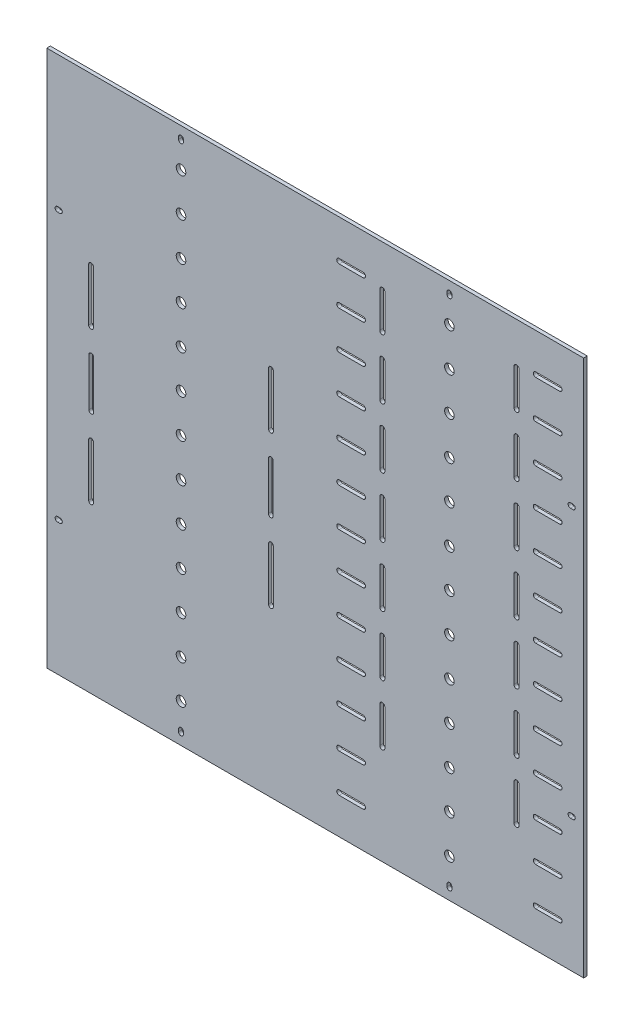
from build123d import *

# Parameters (mm, degrees)
SCHIZZO1_W                   = 448
SCHIZZO1_H                   = 448
SCHIZZO1_R                   = 4
ESTRUSIONE_ESTRUSIONE1_DEPTH = 3


with BuildPart() as part:
    # Schizzo1 → Estrusione-Estrusione1 (new body)
    with BuildSketch(Plane.XY):
        with Locations((224, 224)):
            Rectangle(SCHIZZO1_W, SCHIZZO1_H)
        with Locations((335.970716632, 416)):
            Circle(SCHIZZO1_R, mode=Mode.SUBTRACT)
        with Locations((335.970716632, 384)):
            Circle(SCHIZZO1_R, mode=Mode.SUBTRACT)
        with Locations((335.970716632, 352)):
            Circle(SCHIZZO1_R, mode=Mode.SUBTRACT)
        with Locations((335.970716632, 320)):
            Circle(SCHIZZO1_R, mode=Mode.SUBTRACT)
        with Locations((335.970716632, 288)):
            Circle(SCHIZZO1_R, mode=Mode.SUBTRACT)
        with Locations((335.970716632, 256)):
            Circle(SCHIZZO1_R, mode=Mode.SUBTRACT)
        with Locations((335.970716632, 224)):
            Circle(SCHIZZO1_R, mode=Mode.SUBTRACT)
        with Locations((335.970716632, 192)):
            Circle(SCHIZZO1_R, mode=Mode.SUBTRACT)
        with Locations((335.970716632, 160)):
            Circle(SCHIZZO1_R, mode=Mode.SUBTRACT)
        with Locations((335.970716632, 128)):
            Circle(SCHIZZO1_R, mode=Mode.SUBTRACT)
        with Locations((335.970716632, 96)):
            Circle(SCHIZZO1_R, mode=Mode.SUBTRACT)
        with Locations((335.970716632, 64)):
            Circle(SCHIZZO1_R, mode=Mode.SUBTRACT)
        with Locations((335.970716632, 32)):
            Circle(SCHIZZO1_R, mode=Mode.SUBTRACT)
        with Locations(Location((112.029283368, 32, 0), (0, 0, 180))):
            Circle(SCHIZZO1_R, mode=Mode.SUBTRACT)
        with Locations(Location((112.029283368, 64, 0), (0, 0, 180))):
            Circle(SCHIZZO1_R, mode=Mode.SUBTRACT)
        with Locations(Location((112.029283368, 96, 0), (0, 0, 180))):
            Circle(SCHIZZO1_R, mode=Mode.SUBTRACT)
        with Locations(Location((112.029283368, 128, 0), (0, 0, 180))):
            Circle(SCHIZZO1_R, mode=Mode.SUBTRACT)
        with Locations(Location((112.029283368, 160, 0), (0, 0, 180))):
            Circle(SCHIZZO1_R, mode=Mode.SUBTRACT)
        with Locations(Location((112.029283368, 192, 0), (0, 0, 180))):
            Circle(SCHIZZO1_R, mode=Mode.SUBTRACT)
        with Locations(Location((112.029283368, 224, 0), (0, 0, 180))):
            Circle(SCHIZZO1_R, mode=Mode.SUBTRACT)
        with Locations(Location((112.029283368, 256, 0), (0, 0, 180))):
            Circle(SCHIZZO1_R, mode=Mode.SUBTRACT)
        with Locations(Location((112.029283368, 288, 0), (0, 0, 180))):
            Circle(SCHIZZO1_R, mode=Mode.SUBTRACT)
        with Locations(Location((112.029283368, 320, 0), (0, 0, 180))):
            Circle(SCHIZZO1_R, mode=Mode.SUBTRACT)
        with Locations(Location((112.029283368, 352, 0), (0, 0, 180))):
            Circle(SCHIZZO1_R, mode=Mode.SUBTRACT)
        with Locations(Location((112.029283368, 384, 0), (0, 0, 180))):
            Circle(SCHIZZO1_R, mode=Mode.SUBTRACT)
        with Locations(Location((112.029283368, 416, 0), (0, 0, 180))):
            Circle(SCHIZZO1_R, mode=Mode.SUBTRACT)
        with BuildLine():
            Line((9, 338), (11, 338))
            ThreePointArc((11, 338), (13, 336), (11, 334))
            Line((11, 334), (9, 334))
            ThreePointArc((9, 334), (7, 336), (9, 338))
        make_face(mode=Mode.SUBTRACT)
        with BuildLine():
            Line((9, 110), (11, 110))
            ThreePointArc((11, 110), (13, 112), (11, 114))
            Line((11, 114), (9, 114))
            ThreePointArc((9, 114), (7, 112), (9, 110))
        make_face(mode=Mode.SUBTRACT)
        with BuildLine():
            Line((439, 110), (437, 110))
            ThreePointArc((437, 110), (435, 112), (437, 114))
            Line((437, 114), (439, 114))
            ThreePointArc((439, 114), (441, 112), (439, 110))
        make_face(mode=Mode.SUBTRACT)
        with BuildLine():
            Line((439, 338), (437, 338))
            ThreePointArc((437, 338), (435, 336), (437, 334))
            Line((437, 334), (439, 334))
            ThreePointArc((439, 334), (441, 336), (439, 338))
        make_face(mode=Mode.SUBTRACT)
        with BuildLine():
            Line((114, 439), (114, 437))
            ThreePointArc((114, 437), (112, 435), (110, 437))
            Line((110, 437), (110, 439))
            ThreePointArc((110, 439), (112, 441), (114, 439))
        make_face(mode=Mode.SUBTRACT)
        with BuildLine():
            Line((334, 439), (334, 437))
            ThreePointArc((334, 437), (336, 435), (338, 437))
            Line((338, 437), (338, 439))
            ThreePointArc((338, 439), (336, 441), (334, 439))
        make_face(mode=Mode.SUBTRACT)
        with BuildLine():
            Line((114, 9), (114, 11))
            ThreePointArc((114, 11), (112, 13), (110, 11))
            Line((110, 11), (110, 9))
            ThreePointArc((110, 9), (112, 7), (114, 9))
        make_face(mode=Mode.SUBTRACT)
        with BuildLine():
            Line((334, 9), (334, 11))
            ThreePointArc((334, 11), (336, 13), (338, 11))
            Line((338, 11), (338, 9))
            ThreePointArc((338, 9), (336, 7), (334, 9))
        make_face(mode=Mode.SUBTRACT)
        with BuildLine():
            Line((34.958788995, 265.366145204), (34.958788995, 309.366145204))
            ThreePointArc((34.958788995, 309.366145204), (36.958788995, 311.366145204), (38.958788995, 309.366145204))
            Line((38.958788995, 309.366145204), (38.958788995, 265.366145204))
            ThreePointArc((38.958788995, 265.366145204), (36.958788995, 263.366145204), (34.958788995, 265.366145204))
        make_face(mode=Mode.SUBTRACT)
        with BuildLine():
            Line((34.958788995, 182.633854796), (34.958788995, 138.633854796))
            ThreePointArc((34.958788995, 138.633854796), (36.958788995, 136.633854796), (38.958788995, 138.633854796))
            Line((38.958788995, 138.633854796), (38.958788995, 182.633854796))
            ThreePointArc((38.958788995, 182.633854796), (36.958788995, 184.633854796), (34.958788995, 182.633854796))
        make_face(mode=Mode.SUBTRACT)
        with BuildLine():
            Line((35.086959829, 204.138830615), (35.086959829, 244.138830615))
            ThreePointArc((35.086959829, 244.138830615), (37.086959829, 246.138830615), (39.086959829, 244.138830615))
            Line((39.086959829, 244.138830615), (39.086959829, 204.138830615))
            ThreePointArc((39.086959829, 204.138830615), (37.086959829, 202.138830615), (35.086959829, 204.138830615))
        make_face(mode=Mode.SUBTRACT)
        with BuildLine():
            Line((189.041211005, 265.366145204), (189.041211005, 309.366145204))
            ThreePointArc((189.041211005, 309.366145204), (187.041211005, 311.366145204), (185.041211005, 309.366145204))
            Line((185.041211005, 309.366145204), (185.041211005, 265.366145204))
            ThreePointArc((185.041211005, 265.366145204), (187.041211005, 263.366145204), (189.041211005, 265.366145204))
        make_face(mode=Mode.SUBTRACT)
        with BuildLine():
            Line((188.913040171, 204.138830615), (188.913040171, 244.138830615))
            ThreePointArc((188.913040171, 244.138830615), (186.913040171, 246.138830615), (184.913040171, 244.138830615))
            Line((184.913040171, 244.138830615), (184.913040171, 204.138830615))
            ThreePointArc((184.913040171, 204.138830615), (186.913040171, 202.138830615), (188.913040171, 204.138830615))
        make_face(mode=Mode.SUBTRACT)
        with BuildLine():
            Line((189.041211005, 182.633854796), (189.041211005, 138.633854796))
            ThreePointArc((189.041211005, 138.633854796), (187.041211005, 136.633854796), (185.041211005, 138.633854796))
            Line((185.041211005, 138.633854796), (185.041211005, 182.633854796))
            ThreePointArc((185.041211005, 182.633854796), (187.041211005, 184.633854796), (189.041211005, 182.633854796))
        make_face(mode=Mode.SUBTRACT)
        with BuildLine():
            Line((243.970716252, 418), (263.970716252, 418))
            ThreePointArc((263.970716252, 418), (265.970716252, 416), (263.970716252, 414))
            Line((263.970716252, 414), (243.970716252, 414))
            ThreePointArc((243.970716252, 414), (241.970716252, 416), (243.970716252, 418))
        make_face(mode=Mode.SUBTRACT)
        with BuildLine():
            Line((427.970329998, 418.017724106), (407.970330369, 418.013871032))
            ThreePointArc((407.970330369, 418.013871032), (405.970715714, 416.013485761), (407.971100984, 414.013871106))
            Line((407.971100984, 414.013871106), (427.971100613, 414.017724181))
            ThreePointArc((427.971100613, 414.017724181), (429.970715268, 416.018109451), (427.970329998, 418.017724106))
        make_face(mode=Mode.SUBTRACT)
        with BuildLine():
            Line((243.970716252, 386), (263.970716252, 386))
            ThreePointArc((263.970716252, 386), (265.970716252, 384), (263.970716252, 382))
            Line((263.970716252, 382), (243.970716252, 382))
            ThreePointArc((243.970716252, 382), (241.970716252, 384), (243.970716252, 386))
        make_face(mode=Mode.SUBTRACT)
        with BuildLine():
            Line((427.970329998, 386.017724106), (407.970330369, 386.013871032))
            ThreePointArc((407.970330369, 386.013871032), (405.970715714, 384.013485761), (407.971100984, 382.013871106))
            Line((407.971100984, 382.013871106), (427.971100613, 382.017724181))
            ThreePointArc((427.971100613, 382.017724181), (429.970715268, 384.018109451), (427.970329998, 386.017724106))
        make_face(mode=Mode.SUBTRACT)
        with BuildLine():
            Line((277.872450261, 383.004982615), (277.872450261, 412.995017385))
            ThreePointArc((277.872450261, 412.995017385), (279.972450256, 415.09501738), (282.072450251, 412.995017385))
            Line((282.072450251, 412.995017385), (282.072450251, 383.004982615))
            ThreePointArc((282.072450251, 383.004982615), (279.972450256, 380.90498262), (277.872450261, 383.004982615))
        make_face(mode=Mode.SUBTRACT)
        with BuildLine():
            Line((243.970716252, 354), (263.970716252, 354))
            ThreePointArc((263.970716252, 354), (265.970716252, 352), (263.970716252, 350))
            Line((263.970716252, 350), (243.970716252, 350))
            ThreePointArc((243.970716252, 350), (241.970716252, 352), (243.970716252, 354))
        make_face(mode=Mode.SUBTRACT)
        with BuildLine():
            Line((427.970329998, 354.017724106), (407.970330369, 354.013871032))
            ThreePointArc((407.970330369, 354.013871032), (405.970715714, 352.013485761), (407.971100984, 350.013871106))
            Line((407.971100984, 350.013871106), (427.971100613, 350.017724181))
            ThreePointArc((427.971100613, 350.017724181), (429.970715268, 352.018109451), (427.970329998, 354.017724106))
        make_face(mode=Mode.SUBTRACT)
        with BuildLine():
            Line((243.970716252, 322), (263.970716252, 322))
            ThreePointArc((263.970716252, 322), (265.970716252, 320), (263.970716252, 318))
            Line((263.970716252, 318), (243.970716252, 318))
            ThreePointArc((243.970716252, 318), (241.970716252, 320), (243.970716252, 322))
        make_face(mode=Mode.SUBTRACT)
        with BuildLine():
            Line((427.970329998, 322.017724106), (407.970330369, 322.013871032))
            ThreePointArc((407.970330369, 322.013871032), (405.970715714, 320.013485761), (407.971100984, 318.013871106))
            Line((407.971100984, 318.013871106), (427.971100613, 318.017724181))
            ThreePointArc((427.971100613, 318.017724181), (429.970715268, 320.018109451), (427.970329998, 322.017724106))
        make_face(mode=Mode.SUBTRACT)
        with BuildLine():
            Line((394.072449736, 383.005806193), (394.072449736, 413.015771025))
            ThreePointArc((394.072449736, 413.015771025), (391.972449736, 415.115771025), (389.872449736, 413.015771025))
            Line((389.872449736, 413.015771025), (389.872449736, 383.005806193))
            ThreePointArc((389.872449736, 383.005806193), (391.972449736, 380.905806193), (394.072449736, 383.005806193))
        make_face(mode=Mode.SUBTRACT)
        with BuildLine():
            Line((243.970716252, 290), (263.970716252, 290))
            ThreePointArc((263.970716252, 290), (265.970716252, 288), (263.970716252, 286))
            Line((263.970716252, 286), (243.970716252, 286))
            ThreePointArc((243.970716252, 286), (241.970716252, 288), (243.970716252, 290))
        make_face(mode=Mode.SUBTRACT)
        with BuildLine():
            Line((427.970329998, 290.017724106), (407.970330369, 290.013871032))
            ThreePointArc((407.970330369, 290.013871032), (405.970715714, 288.013485761), (407.971100984, 286.013871106))
            Line((407.971100984, 286.013871106), (427.971100613, 286.017724181))
            ThreePointArc((427.971100613, 286.017724181), (429.970715268, 288.018109451), (427.970329998, 290.017724106))
        make_face(mode=Mode.SUBTRACT)
        with BuildLine():
            Line((243.970716252, 258), (263.970716252, 258))
            ThreePointArc((263.970716252, 258), (265.970716252, 256), (263.970716252, 254))
            Line((263.970716252, 254), (243.970716252, 254))
            ThreePointArc((243.970716252, 254), (241.970716252, 256), (243.970716252, 258))
        make_face(mode=Mode.SUBTRACT)
        with BuildLine():
            Line((427.970329998, 258.017724106), (407.970330369, 258.013871032))
            ThreePointArc((407.970330369, 258.013871032), (405.970715714, 256.013485761), (407.971100984, 254.013871106))
            Line((407.971100984, 254.013871106), (427.971100613, 254.017724181))
            ThreePointArc((427.971100613, 254.017724181), (429.970715268, 256.018109451), (427.970329998, 258.017724106))
        make_face(mode=Mode.SUBTRACT)
        with BuildLine():
            Line((243.970716252, 226), (263.970716252, 226))
            ThreePointArc((263.970716252, 226), (265.970716252, 224), (263.970716252, 222))
            Line((263.970716252, 222), (243.970716252, 222))
            ThreePointArc((243.970716252, 222), (241.970716252, 224), (243.970716252, 226))
        make_face(mode=Mode.SUBTRACT)
        with BuildLine():
            Line((427.970329998, 226.017724106), (407.970330369, 226.013871032))
            ThreePointArc((407.970330369, 226.013871032), (405.970715714, 224.013485761), (407.971100984, 222.013871106))
            Line((407.971100984, 222.013871106), (427.971100613, 222.017724181))
            ThreePointArc((427.971100613, 222.017724181), (429.970715268, 224.018109451), (427.970329998, 226.017724106))
        make_face(mode=Mode.SUBTRACT)
        with BuildLine():
            Line((243.970716252, 194), (263.970716252, 194))
            ThreePointArc((263.970716252, 194), (265.970716252, 192), (263.970716252, 190))
            Line((263.970716252, 190), (243.970716252, 190))
            ThreePointArc((243.970716252, 190), (241.970716252, 192), (243.970716252, 194))
        make_face(mode=Mode.SUBTRACT)
        with BuildLine():
            Line((427.970329998, 194.017724106), (407.970330369, 194.013871032))
            ThreePointArc((407.970330369, 194.013871032), (405.970715714, 192.013485761), (407.971100984, 190.013871106))
            Line((407.971100984, 190.013871106), (427.971100613, 190.017724181))
            ThreePointArc((427.971100613, 190.017724181), (429.970715268, 192.018109451), (427.970329998, 194.017724106))
        make_face(mode=Mode.SUBTRACT)
        with BuildLine():
            Line((243.970716252, 162), (263.970716252, 162))
            ThreePointArc((263.970716252, 162), (265.970716252, 160), (263.970716252, 158))
            Line((263.970716252, 158), (243.970716252, 158))
            ThreePointArc((243.970716252, 158), (241.970716252, 160), (243.970716252, 162))
        make_face(mode=Mode.SUBTRACT)
        with BuildLine():
            Line((427.970329998, 162.017724106), (407.970330369, 162.013871032))
            ThreePointArc((407.970330369, 162.013871032), (405.970715714, 160.013485761), (407.971100984, 158.013871106))
            Line((407.971100984, 158.013871106), (427.971100613, 158.017724181))
            ThreePointArc((427.971100613, 158.017724181), (429.970715268, 160.018109451), (427.970329998, 162.017724106))
        make_face(mode=Mode.SUBTRACT)
        with BuildLine():
            Line((243.970716252, 130), (263.970716252, 130))
            ThreePointArc((263.970716252, 130), (265.970716252, 128), (263.970716252, 126))
            Line((263.970716252, 126), (243.970716252, 126))
            ThreePointArc((243.970716252, 126), (241.970716252, 128), (243.970716252, 130))
        make_face(mode=Mode.SUBTRACT)
        with BuildLine():
            Line((427.970329998, 130.017724106), (407.970330369, 130.013871032))
            ThreePointArc((407.970330369, 130.013871032), (405.970715714, 128.013485761), (407.971100984, 126.013871106))
            Line((407.971100984, 126.013871106), (427.971100613, 126.017724181))
            ThreePointArc((427.971100613, 126.017724181), (429.970715268, 128.018109451), (427.970329998, 130.017724106))
        make_face(mode=Mode.SUBTRACT)
        with BuildLine():
            Line((277.872450261, 333.004982615), (277.872450261, 362.995017385))
            ThreePointArc((277.872450261, 362.995017385), (279.972450256, 365.09501738), (282.072450251, 362.995017385))
            Line((282.072450251, 362.995017385), (282.072450251, 333.004982615))
            ThreePointArc((282.072450251, 333.004982615), (279.972450256, 330.90498262), (277.872450261, 333.004982615))
        make_face(mode=Mode.SUBTRACT)
        with BuildLine():
            Line((394.072449736, 333.005806193), (394.072449736, 363.015771025))
            ThreePointArc((394.072449736, 363.015771025), (391.972449736, 365.115771025), (389.872449736, 363.015771025))
            Line((389.872449736, 363.015771025), (389.872449736, 333.005806193))
            ThreePointArc((389.872449736, 333.005806193), (391.972449736, 330.905806193), (394.072449736, 333.005806193))
        make_face(mode=Mode.SUBTRACT)
        with BuildLine():
            Line((277.872450261, 283.004982615), (277.872450261, 312.995017385))
            ThreePointArc((277.872450261, 312.995017385), (279.972450256, 315.09501738), (282.072450251, 312.995017385))
            Line((282.072450251, 312.995017385), (282.072450251, 283.004982615))
            ThreePointArc((282.072450251, 283.004982615), (279.972450256, 280.90498262), (277.872450261, 283.004982615))
        make_face(mode=Mode.SUBTRACT)
        with BuildLine():
            Line((394.072449736, 283.005806193), (394.072449736, 313.015771025))
            ThreePointArc((394.072449736, 313.015771025), (391.972449736, 315.115771025), (389.872449736, 313.015771025))
            Line((389.872449736, 313.015771025), (389.872449736, 283.005806193))
            ThreePointArc((389.872449736, 283.005806193), (391.972449736, 280.905806193), (394.072449736, 283.005806193))
        make_face(mode=Mode.SUBTRACT)
        with BuildLine():
            Line((277.872450261, 233.004982615), (277.872450261, 262.995017385))
            ThreePointArc((277.872450261, 262.995017385), (279.972450256, 265.09501738), (282.072450251, 262.995017385))
            Line((282.072450251, 262.995017385), (282.072450251, 233.004982615))
            ThreePointArc((282.072450251, 233.004982615), (279.972450256, 230.90498262), (277.872450261, 233.004982615))
        make_face(mode=Mode.SUBTRACT)
        with BuildLine():
            Line((394.072449736, 233.005806193), (394.072449736, 263.015771025))
            ThreePointArc((394.072449736, 263.015771025), (391.972449736, 265.115771025), (389.872449736, 263.015771025))
            Line((389.872449736, 263.015771025), (389.872449736, 233.005806193))
            ThreePointArc((389.872449736, 233.005806193), (391.972449736, 230.905806193), (394.072449736, 233.005806193))
        make_face(mode=Mode.SUBTRACT)
        with BuildLine():
            Line((277.872450261, 183.004982615), (277.872450261, 212.995017385))
            ThreePointArc((277.872450261, 212.995017385), (279.972450256, 215.09501738), (282.072450251, 212.995017385))
            Line((282.072450251, 212.995017385), (282.072450251, 183.004982615))
            ThreePointArc((282.072450251, 183.004982615), (279.972450256, 180.90498262), (277.872450261, 183.004982615))
        make_face(mode=Mode.SUBTRACT)
        with BuildLine():
            Line((394.072449736, 183.005806193), (394.072449736, 213.015771025))
            ThreePointArc((394.072449736, 213.015771025), (391.972449736, 215.115771025), (389.872449736, 213.015771025))
            Line((389.872449736, 213.015771025), (389.872449736, 183.005806193))
            ThreePointArc((389.872449736, 183.005806193), (391.972449736, 180.905806193), (394.072449736, 183.005806193))
        make_face(mode=Mode.SUBTRACT)
        with BuildLine():
            Line((277.872450261, 133.004982615), (277.872450261, 162.995017385))
            ThreePointArc((277.872450261, 162.995017385), (279.972450256, 165.09501738), (282.072450251, 162.995017385))
            Line((282.072450251, 162.995017385), (282.072450251, 133.004982615))
            ThreePointArc((282.072450251, 133.004982615), (279.972450256, 130.90498262), (277.872450261, 133.004982615))
        make_face(mode=Mode.SUBTRACT)
        with BuildLine():
            Line((394.072449736, 133.005806193), (394.072449736, 163.015771025))
            ThreePointArc((394.072449736, 163.015771025), (391.972449736, 165.115771025), (389.872449736, 163.015771025))
            Line((389.872449736, 163.015771025), (389.872449736, 133.005806193))
            ThreePointArc((389.872449736, 133.005806193), (391.972449736, 130.905806193), (394.072449736, 133.005806193))
        make_face(mode=Mode.SUBTRACT)
        with BuildLine():
            Line((277.872450261, 83.004982615), (277.872450261, 112.995017385))
            ThreePointArc((277.872450261, 112.995017385), (279.972450256, 115.09501738), (282.072450251, 112.995017385))
            Line((282.072450251, 112.995017385), (282.072450251, 83.004982615))
            ThreePointArc((282.072450251, 83.004982615), (279.972450256, 80.90498262), (277.872450261, 83.004982615))
        make_face(mode=Mode.SUBTRACT)
        with BuildLine():
            Line((394.072449736, 83.005806193), (394.072449736, 113.015771025))
            ThreePointArc((394.072449736, 113.015771025), (391.972449736, 115.115771025), (389.872449736, 113.015771025))
            Line((389.872449736, 113.015771025), (389.872449736, 83.005806193))
            ThreePointArc((389.872449736, 83.005806193), (391.972449736, 80.905806193), (394.072449736, 83.005806193))
        make_face(mode=Mode.SUBTRACT)
        with BuildLine():
            Line((243.970716252, 98), (263.970716252, 98))
            ThreePointArc((263.970716252, 98), (265.970716252, 96), (263.970716252, 94))
            Line((263.970716252, 94), (243.970716252, 94))
            ThreePointArc((243.970716252, 94), (241.970716252, 96), (243.970716252, 98))
        make_face(mode=Mode.SUBTRACT)
        with BuildLine():
            Line((427.970329998, 98.017724106), (407.970330369, 98.013871032))
            ThreePointArc((407.970330369, 98.013871032), (405.970715714, 96.013485761), (407.971100984, 94.013871106))
            Line((407.971100984, 94.013871106), (427.971100613, 94.017724181))
            ThreePointArc((427.971100613, 94.017724181), (429.970715268, 96.018109451), (427.970329998, 98.017724106))
        make_face(mode=Mode.SUBTRACT)
        with BuildLine():
            Line((243.970716252, 66), (263.970716252, 66))
            ThreePointArc((263.970716252, 66), (265.970716252, 64), (263.970716252, 62))
            Line((263.970716252, 62), (243.970716252, 62))
            ThreePointArc((243.970716252, 62), (241.970716252, 64), (243.970716252, 66))
        make_face(mode=Mode.SUBTRACT)
        with BuildLine():
            Line((427.970329998, 66.017724106), (407.970330369, 66.013871032))
            ThreePointArc((407.970330369, 66.013871032), (405.970715714, 64.013485761), (407.971100984, 62.013871106))
            Line((407.971100984, 62.013871106), (427.971100613, 62.017724181))
            ThreePointArc((427.971100613, 62.017724181), (429.970715268, 64.018109451), (427.970329998, 66.017724106))
        make_face(mode=Mode.SUBTRACT)
        with BuildLine():
            Line((243.970716252, 34), (263.970716252, 34))
            ThreePointArc((263.970716252, 34), (265.970716252, 32), (263.970716252, 30))
            Line((263.970716252, 30), (243.970716252, 30))
            ThreePointArc((243.970716252, 30), (241.970716252, 32), (243.970716252, 34))
        make_face(mode=Mode.SUBTRACT)
        with BuildLine():
            Line((427.970329998, 34.017724106), (407.970330369, 34.013871032))
            ThreePointArc((407.970330369, 34.013871032), (405.970715714, 32.013485761), (407.971100984, 30.013871106))
            Line((407.971100984, 30.013871106), (427.971100613, 30.017724181))
            ThreePointArc((427.971100613, 30.017724181), (429.970715268, 32.018109451), (427.970329998, 34.017724106))
        make_face(mode=Mode.SUBTRACT)
    extrude(amount=-ESTRUSIONE_ESTRUSIONE1_DEPTH)


solid = part.part
